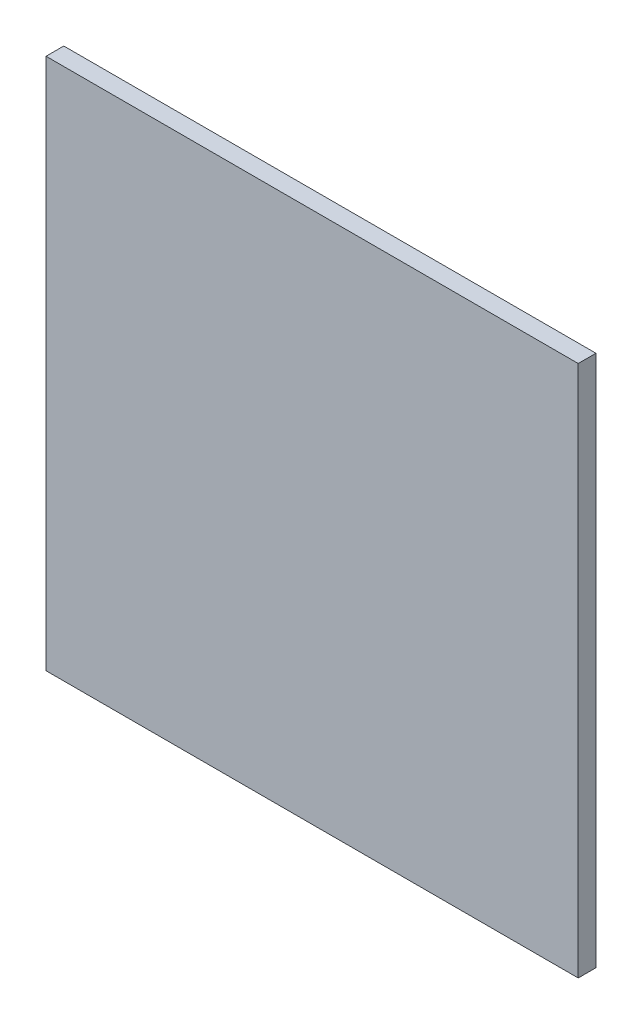
from build123d import *

# Parameters (mm, degrees)
SKETCH1_W           = 300
SKETCH1_H           = 300
BOSS_EXTRUDE1_DEPTH = 10


with BuildPart() as part:
    # Sketch1 → Boss-Extrude1 (new body)
    with BuildSketch(Plane.XY):
        with Locations((70.782531589, -73.342939481)):
            Rectangle(SKETCH1_W, SKETCH1_H)
    extrude(amount=BOSS_EXTRUDE1_DEPTH)


solid = part.part
